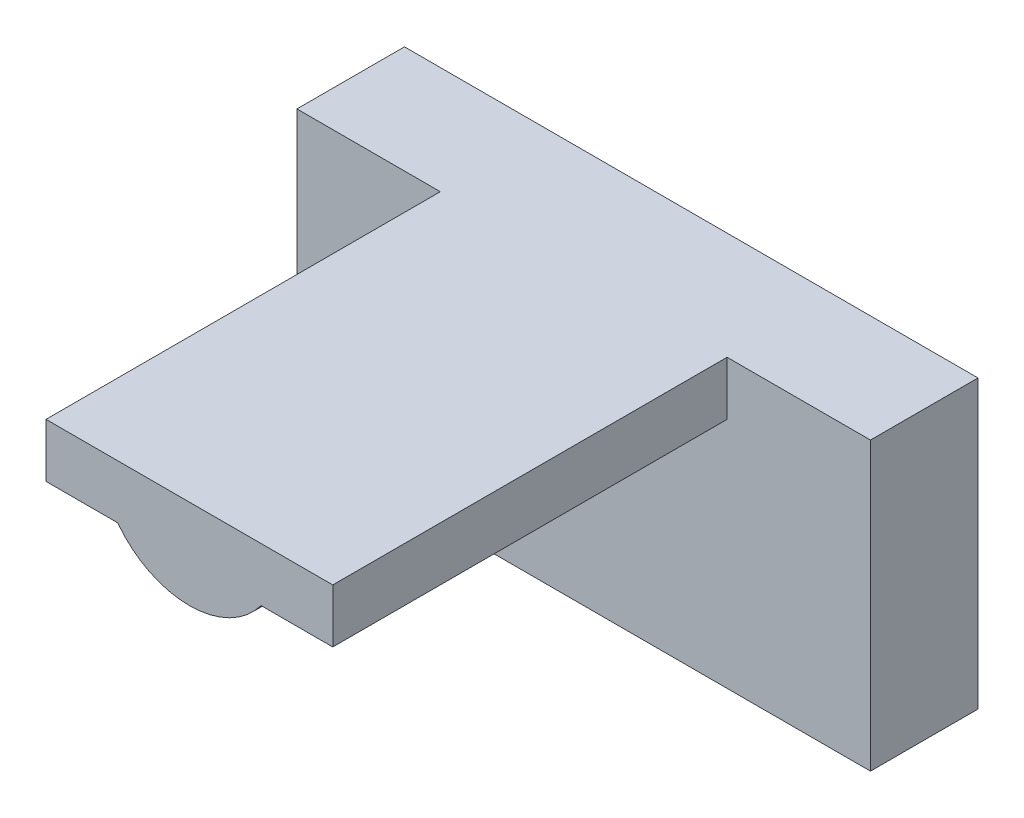
from build123d import *

# Parameters (mm, degrees)
SKETCH1_W           = 16
SKETCH1_H           = 8
BOSS_EXTRUDE1_DEPTH = 3
SHELL3_T            = -1
SKETCH2_R           = 1.5
SKETCH2_R_2         = 0.8
BOSS_EXTRUDE2_DEPTH = 2
BOSS_EXTRUDE3_DEPTH = 11


with BuildPart() as part:
    # Sketch1 → Boss-Extrude1 (new body)
    with BuildSketch(Plane.XY):
        with Locations((-13.569515058, 18.04477027)):
            Rectangle(SKETCH1_W, SKETCH1_H)
    extrude(amount=BOSS_EXTRUDE1_DEPTH)

    # Shell3
    shell3_openings = [part.faces().sort_by_distance(p)[0] for p in [
        (-13.569515058, 18.04477027, 0),
    ]]
    offset(amount=SHELL3_T, openings=shell3_openings, kind=Kind.INTERSECTION)

    # Sketch2 → Boss-Extrude2 (add)
    with BuildSketch(Plane(origin=(0, 0, 2), x_dir=(-1, 0, 0), z_dir=(0, 0, -1))):
        with Locations((13.569515058, 18.04477027)):
            Circle(SKETCH2_R)
        with Locations((13.569515058, 18.04477027)):
            Circle(SKETCH2_R_2, mode=Mode.SUBTRACT)
    extrude(amount=BOSS_EXTRUDE2_DEPTH)

    # Sketch3 → Boss-Extrude3 (add)
    with BuildSketch(Plane.XY.offset(3)):
        with BuildLine():
            Line((-17.569515058, 22.04477027), (-17.569515058, 20.54477027))
            Line((-17.569515058, 20.54477027), (-15.569515058, 20.54477027))
            ThreePointArc((-15.569515058, 20.54477027), (-13.569515058, 19.54477027), (-11.569515058, 20.54477027))
            Line((-11.569515058, 20.54477027), (-9.569515058, 20.54477027))
            Line((-9.569515058, 20.54477027), (-9.569515058, 22.04477027))
            Line((-9.569515058, 22.04477027), (-17.569515058, 22.04477027))
        make_face()
    extrude(amount=BOSS_EXTRUDE3_DEPTH)


solid = part.part
